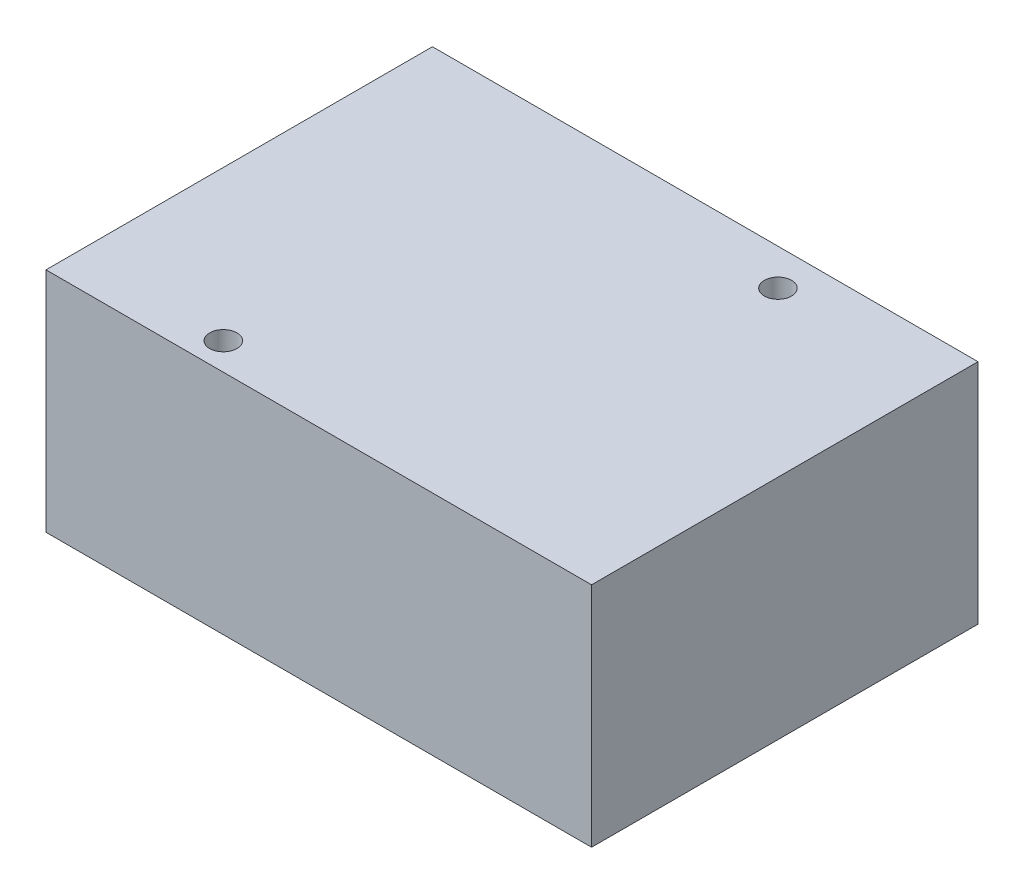
from build123d import *

# Parameters (mm, degrees)
SKETCH1_W           = 60
SKETCH1_H           = 42.5
BOSS_EXTRUDE1_DEPTH = 25
SKETCH2_R           = 1.5
CUT_EXTRUDE1_DEPTH  = 45.458548109


with BuildPart() as part:
    # Sketch1 → Boss-Extrude1 (new body)
    with BuildSketch(Plane(origin=(0, 0, 0), x_dir=(1, 0, 0), z_dir=(0, 1, 0))):
        Rectangle(SKETCH1_W, SKETCH1_H)
    extrude(amount=BOSS_EXTRUDE1_DEPTH)

    # Sketch2 → Cut-Extrude1 (cut, through all)
    with BuildSketch(Plane(origin=(0, 25, 0), x_dir=(1, 0, 0), z_dir=(0, 1, 0))):
        with Locations(Location((12, 17.25, 0), (0, 0, 270))):
            Circle(SKETCH2_R)
        with Locations(Location((-13.5, -18.25, 0), (0, 0, 270))):
            Circle(SKETCH2_R)
    extrude(amount=-CUT_EXTRUDE1_DEPTH, mode=Mode.SUBTRACT)


solid = part.part
